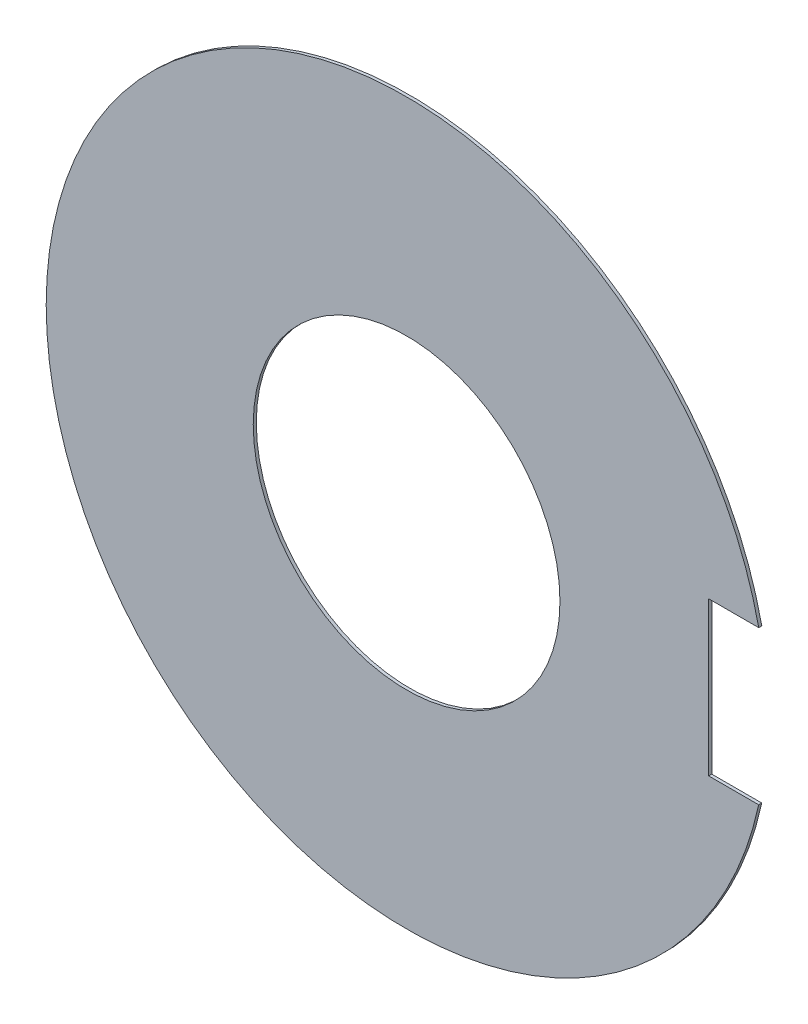
from build123d import *

# Parameters (mm, degrees)
SKETCH1_R           = 29.845
SKETCH1_R_2         = 12.7
BOSS_EXTRUDE1_DEPTH = 0.254
SKETCH2_W           = 6.745190644
SKETCH2_H           = 12.702003304
CUT_EXTRUDE1_DEPTH  = 43.207968039


with BuildPart() as part:
    # Sketch1 → Boss-Extrude1 (new body)
    with BuildSketch(Plane.XY):
        Circle(SKETCH1_R)
        Circle(SKETCH1_R_2, mode=Mode.SUBTRACT)
    extrude(amount=BOSS_EXTRUDE1_DEPTH)

    # Sketch2 → Cut-Extrude1 (cut, through all)
    with BuildSketch(Plane.XY.offset(0.254)):
        with Locations((28.391595322, -0.001001652)):
            Rectangle(SKETCH2_W, SKETCH2_H)
    extrude(amount=-CUT_EXTRUDE1_DEPTH, mode=Mode.SUBTRACT)


solid = part.part
